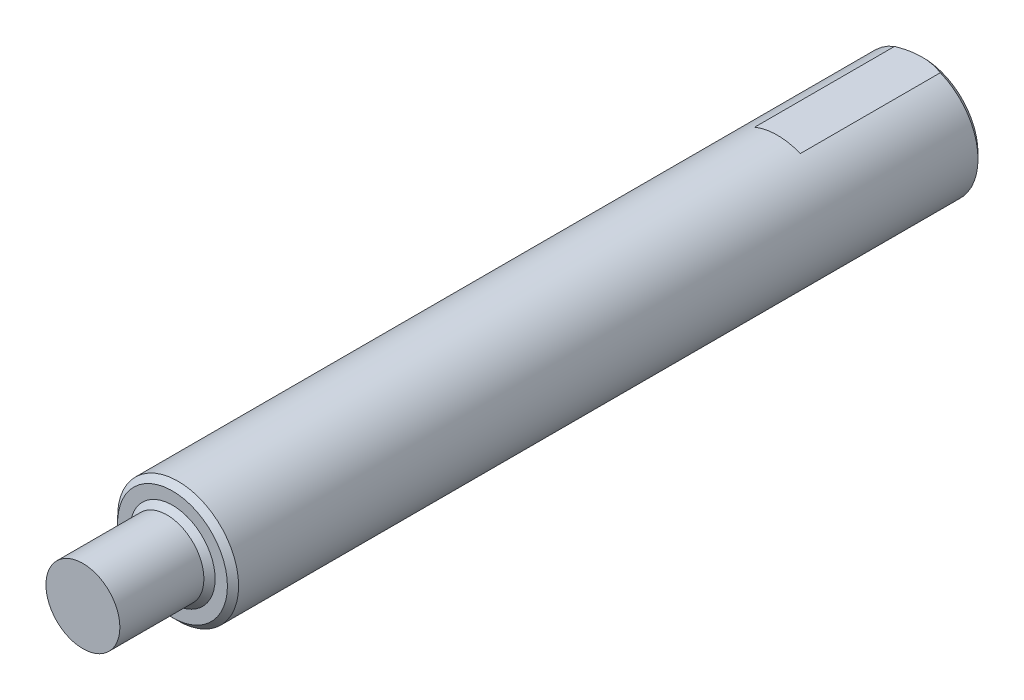
from build123d import *

# Parameters (mm, degrees)
SKETCH_1_R             = 5.4
EXTRUDE_1_DEPTH        = 67
CHAMFER_1_SIZE         = 0.5
SKETCH_2_R             = 3.3
EXTRUDE_2_DEPTH        = 8
HOLE_WIZARD_M5_1_D     = 4.2
HOLE_WIZARD_M5_1_DEPTH = 12.4
HOLE_WIZARD_M5_1_TIP   = 1.2618073
CHAMFER_3_SIZE         = 0.5
SKETCH_5_W             = 10
SKETCH_5_H             = 3
CUT_EXTRUDE_3_DEPTH    = 13
CHAMFER_4_SIZE         = 0.5


with BuildPart() as part:
    # 草图1 → 拉伸1 (new body)
    with BuildSketch(Plane.XY):
        Circle(SKETCH_1_R)
    extrude(amount=EXTRUDE_1_DEPTH)

    # 倒角1
    chamfer_1_edges = [part.edges().sort_by_distance(p)[0] for p in [
        (-5.4, 0, 0),
        (-5.4, 0, 67),
    ]]
    chamfer(chamfer_1_edges, length=CHAMFER_1_SIZE)

    # 草图2 → 拉伸2 (add)
    with BuildSketch(Plane.XY.offset(67)):
        Circle(SKETCH_2_R)
    extrude(amount=EXTRUDE_2_DEPTH)

    # M5 螺纹孔1
    with Locations(Plane(origin=(0, 0, 0), x_dir=(-1, 0, 0), z_dir=(0, 0, -1))):
        with Locations((0, 0)):
            Hole(HOLE_WIZARD_M5_1_D / 2, depth=HOLE_WIZARD_M5_1_DEPTH)
            with Locations((0, 0, -(HOLE_WIZARD_M5_1_DEPTH + HOLE_WIZARD_M5_1_TIP / 2))):  # 118° drill point
                Cone(0, HOLE_WIZARD_M5_1_D / 2, HOLE_WIZARD_M5_1_TIP, mode=Mode.SUBTRACT)

    # 倒角3
    chamfer_3_edges = [part.edges().sort_by_distance(p)[0] for p in [
        (-2.1, 0, 0),
    ]]
    chamfer(chamfer_3_edges, length=CHAMFER_3_SIZE)

    # 草图5 → 拉伸3 (cut)
    with BuildSketch(Plane.XY):
        with Locations((0, 6.5)):
            Rectangle(SKETCH_5_W, SKETCH_5_H)
    cut_extrude_3 = extrude(amount=CUT_EXTRUDE_3_DEPTH, mode=Mode.SUBTRACT)

    # 镜向1: 拉伸3 across plane
    add(cut_extrude_3.mirror(Plane.ZX), mode=Mode.SUBTRACT)

    # 倒角4
    chamfer_4_edges = [part.edges().sort_by_distance(p)[0] for p in [
        (-3.3, 0, 67),
    ]]
    chamfer(chamfer_4_edges, length=CHAMFER_4_SIZE)


solid = part.part
